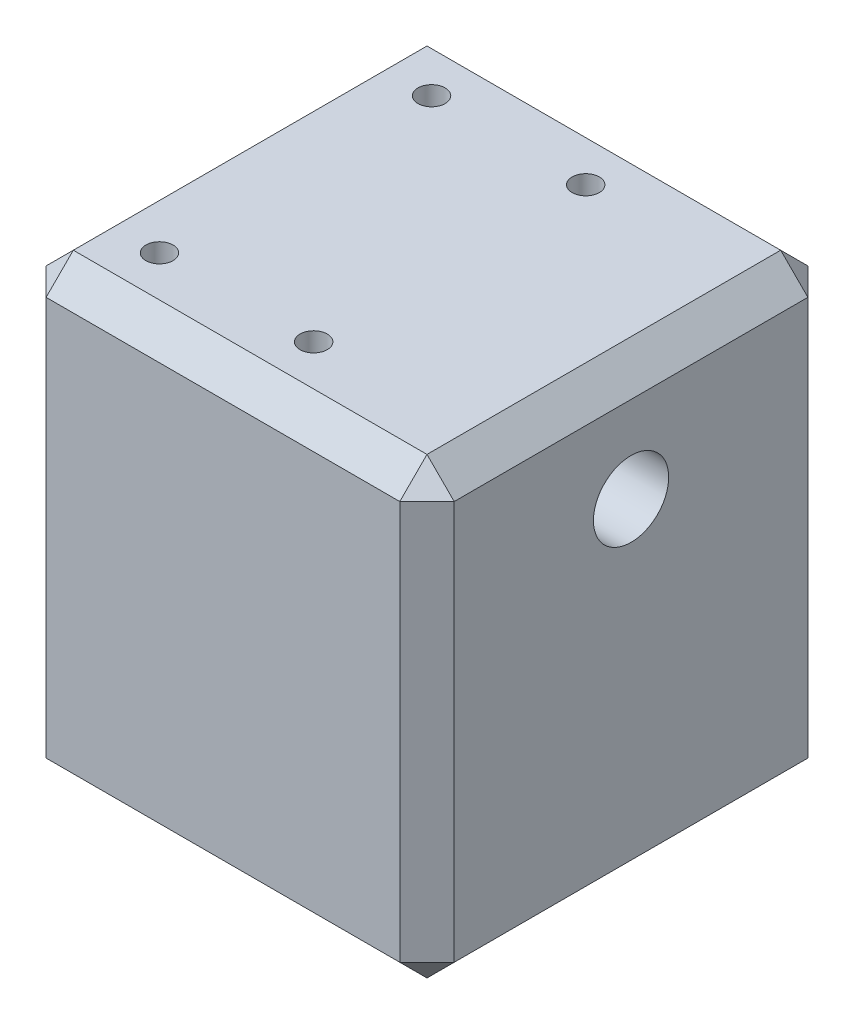
from build123d import *

# Parameters (mm, degrees)
SKETCH1_W           = 45
SKETCH1_H           = 45
BOSS_EXTRUDE1_DEPTH = 50
SKETCH2_R           = 4.15
CUT_EXTRUDE1_DEPTH  = 30
SKETCH3_R           = 4.15
CUT_EXTRUDE2_DEPTH  = 30
CHAMFER1_SIZE       = 3
SKETCH4_R           = 1.5
CUT_EXTRUDE3_DEPTH  = 10


with BuildPart() as part:
    # Sketch1 → Boss-Extrude1 (new body)
    with BuildSketch(Plane(origin=(0, 0, 0), x_dir=(1, 0, 0), z_dir=(0, 1, 0))):
        Rectangle(SKETCH1_W, SKETCH1_H)
    extrude(amount=BOSS_EXTRUDE1_DEPTH)

    # Sketch2 → Cut-Extrude1 (cut)
    with BuildSketch(Plane(origin=(0, 0, -22.5), x_dir=(-1, 0, 0), z_dir=(0, 0, -1))):
        with Locations((0, 12.5)):
            Circle(SKETCH2_R)
    extrude(amount=-CUT_EXTRUDE1_DEPTH, mode=Mode.SUBTRACT)

    # Sketch3 → Cut-Extrude2 (cut)
    with BuildSketch(Plane.ZY.offset(-22.5)):
        with Locations((0, 37.5)):
            Circle(SKETCH3_R)
    extrude(amount=CUT_EXTRUDE2_DEPTH, mode=Mode.SUBTRACT)

    # Chamfer1
    chamfer1_edges = [part.edges().sort_by_distance(p)[0] for p in [
        (-22.5, 50, 0),
        (0, 50, 22.5),
        (22.5, 50, 0),
        (0, 0, 22.5),
        (-22.5, 0, 0),
        (0, 0, -22.5),
        (22.5, 0, 0),
        (22.5, 25, 22.5),
        (-22.5, 25, 22.5),
        (-22.5, 25, -22.5),
        (22.5, 25, -22.5),
        (0, 50, -22.5),
    ]]
    chamfer(chamfer1_edges, length=CHAMFER1_SIZE)

    # Sketch4 → Cut-Extrude3 (cut)
    with BuildSketch(Plane(origin=(0, 50, 0), x_dir=(1, 0, 0), z_dir=(0, 1, 0))):
        with Locations(Location((-14.5, -15, 0), (0, 0, 270))):
            Circle(SKETCH4_R)
        with Locations(Location((2.5, -15, 0), (0, 0, 270))):
            Circle(SKETCH4_R)
        with Locations(Location((2.5, 15, 0), (0, 0, 90))):
            Circle(SKETCH4_R)
        with Locations(Location((-14.5, 15, 0), (0, 0, 90))):
            Circle(SKETCH4_R)
    extrude(amount=-CUT_EXTRUDE3_DEPTH, mode=Mode.SUBTRACT)


solid = part.part
